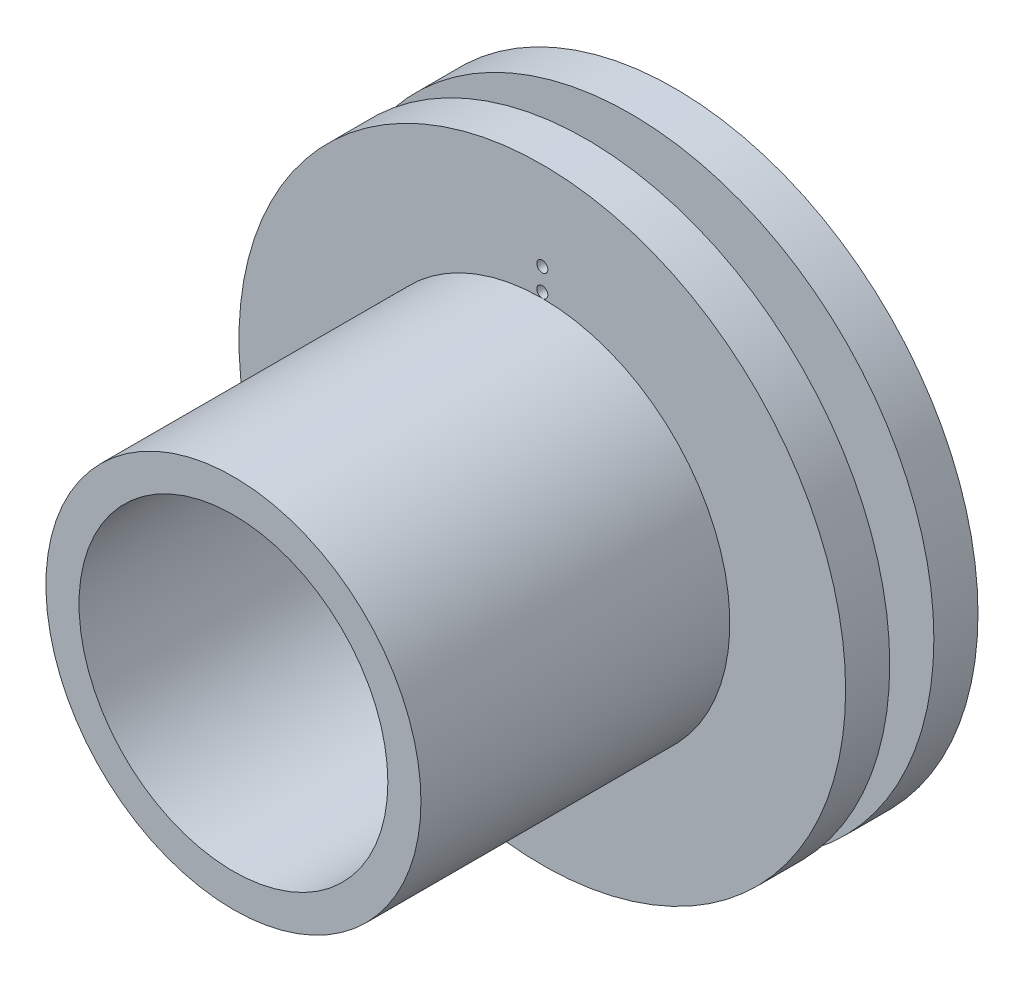
from build123d import *

# Parameters (mm, degrees)
SKETCH1_R           = 13.75
BOSS_EXTRUDE1_DEPTH = 2
SKETCH2_R           = 8.5
BOSS_EXTRUDE2_DEPTH = 6
BOSS_EXTRUDE3_START = 4
SKETCH3_R           = 13.75
BOSS_EXTRUDE3_DEPTH = 2
SKETCH5_R           = 7
CUT_EXTRUDE2_DEPTH  = 21.350061425
BOSS_EXTRUDE4_START = 6
SKETCH6_R           = 8.5
SKETCH6_R_2         = 7
BOSS_EXTRUDE4_DEPTH = 14
CUT_EXTRUDE3_START  = 4
SKETCH9_R           = 0.25
CUT_EXTRUDE3_DEPTH  = 24.894892006


with BuildPart() as part:
    # Sketch1 → Boss-Extrude1 (new body)
    with BuildSketch(Plane.XY):
        Circle(SKETCH1_R)
    extrude(amount=BOSS_EXTRUDE1_DEPTH)

    # Sketch2 → Boss-Extrude2 (add)
    with BuildSketch(Plane.XY):
        Circle(SKETCH2_R)
    extrude(amount=BOSS_EXTRUDE2_DEPTH)

    # Sketch3 → Boss-Extrude3 (add)
    with BuildSketch(Plane.XY.offset(BOSS_EXTRUDE3_START)):
        Circle(SKETCH3_R)
    extrude(amount=BOSS_EXTRUDE3_DEPTH)

    # Sketch5 → Cut-Extrude2 (cut, through all)
    with BuildSketch(Plane.XY):
        Circle(SKETCH5_R)
    extrude(amount=CUT_EXTRUDE2_DEPTH, mode=Mode.SUBTRACT)

    # Sketch6 → Boss-Extrude4 (add)
    with BuildSketch(Plane.XY.offset(BOSS_EXTRUDE4_START)):
        Circle(SKETCH6_R)
        Circle(SKETCH6_R_2, mode=Mode.SUBTRACT)
    extrude(amount=BOSS_EXTRUDE4_DEPTH)

    # Sketch9 → Cut-Extrude3 (cut, through all)
    with BuildSketch(Plane.XY.offset(CUT_EXTRUDE3_START)):
        with Locations((0, 9.75)):
            Circle(SKETCH9_R)
        with Locations((0, -9.75)):
            Circle(SKETCH9_R)
        with Locations(Location((0, 8.75, 0), (0, 0, 270.001597254))):
            Circle(SKETCH9_R)
        with Locations(Location((0, -8.75, 0), (0, 0, 90.001597254))):
            Circle(SKETCH9_R)
    extrude(amount=CUT_EXTRUDE3_DEPTH, mode=Mode.SUBTRACT)


solid = part.part
